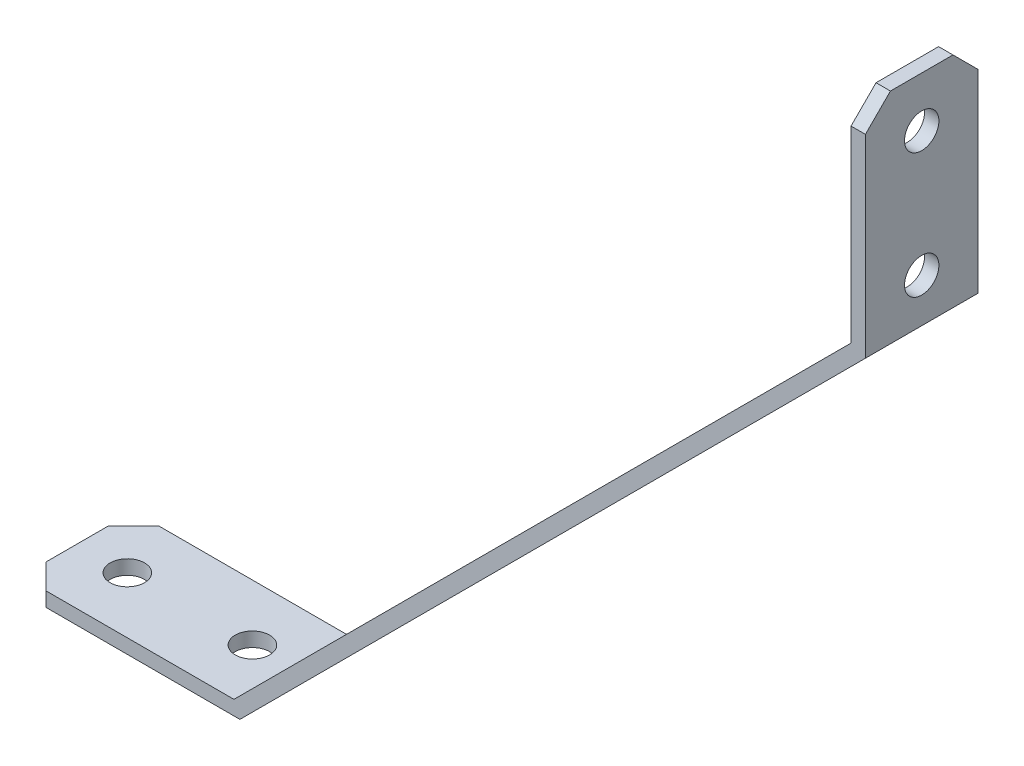
from build123d import *

# Parameters (mm, degrees)
BOSS_EXTRUDE1_DEPTH = 18
SKETCH2_R           = 2.75
CUT_EXTRUDE1_DEPTH  = 191.153332866
CHAMFER1_SIZE       = 4
SKETCH3_R           = 2.75
CUT_EXTRUDE2_DEPTH  = 192.765481774
CHAMFER2_SIZE       = 4


with BuildPart() as part:
    # Sketch1 → Boss-Extrude1 (new body)
    with BuildSketch(Plane.XY):
        Polygon((0, 0), (35, 0), (135, 100), (135, 135), (132.7, 135), (132.7, 100.952691193), (34.047308807, 2.3), (0, 2.3), align=None)
    extrude(amount=BOSS_EXTRUDE1_DEPTH)

    # Sketch2 → Cut-Extrude1 (cut, through all)
    with BuildSketch(Plane.ZY.offset(-132.7)):
        with Locations((9, 127)):
            Circle(SKETCH2_R)
        with Locations((9, 107)):
            Circle(SKETCH2_R)
    extrude(amount=-CUT_EXTRUDE1_DEPTH, mode=Mode.SUBTRACT)

    # Chamfer1
    chamfer1_edges = [part.edges().sort_by_distance(p)[0] for p in [
        (133.85, 135, 18),
        (133.85, 135, 0),
    ]]
    chamfer(chamfer1_edges, length=CHAMFER1_SIZE)

    # Sketch3 → Cut-Extrude2 (cut, through all)
    with BuildSketch(Plane.XZ):
        with Locations(Location((8, 9, 0), (0, 0, 270))):
            Circle(SKETCH3_R)
        with Locations(Location((28, 9, 0), (0, 0, 270))):
            Circle(SKETCH3_R)
    extrude(amount=-CUT_EXTRUDE2_DEPTH, mode=Mode.SUBTRACT)

    # Chamfer2
    chamfer2_edges = [part.edges().sort_by_distance(p)[0] for p in [
        (0, 1.15, 0),
        (0, 1.15, 18),
    ]]
    chamfer(chamfer2_edges, length=CHAMFER2_SIZE)


solid = part.part
